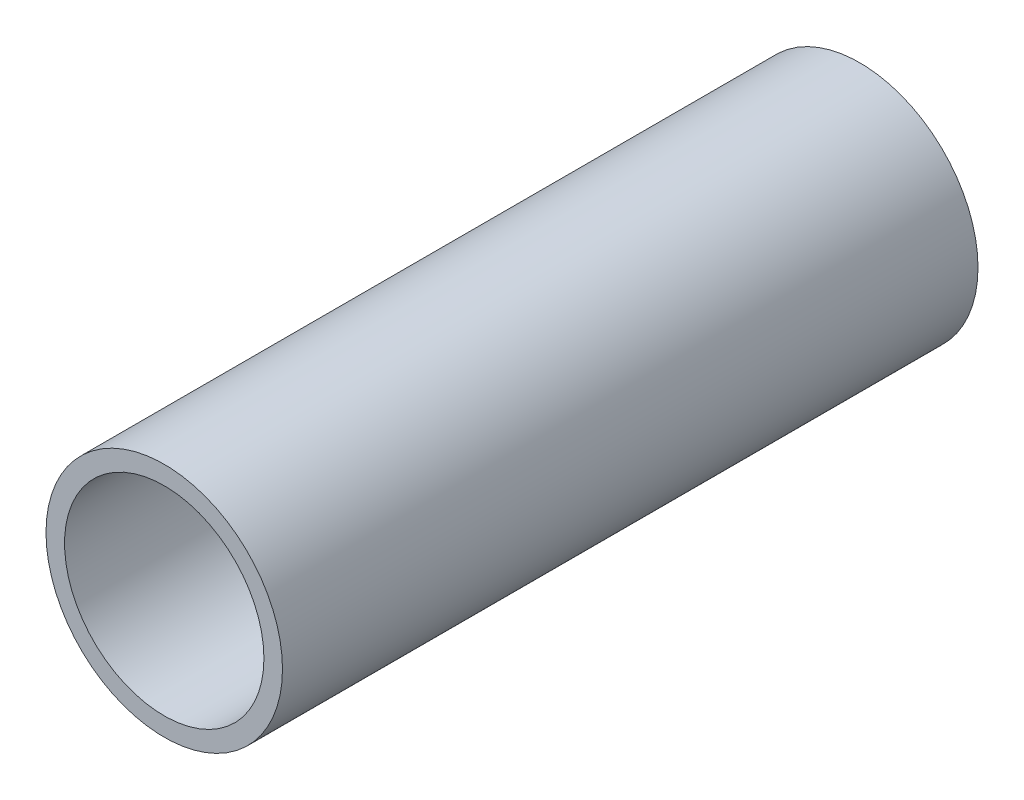
from build123d import *

# Parameters (mm, degrees)
SKETCH3_R           = 2.55
SKETCH3_R_2         = 2.15
BOSS_EXTRUDE1_DEPTH = 15


with BuildPart() as part:
    # Sketch3 → Boss-Extrude1 (new body)
    with BuildSketch(Plane.XY):
        Circle(SKETCH3_R)
        Circle(SKETCH3_R_2, mode=Mode.SUBTRACT)
    extrude(amount=BOSS_EXTRUDE1_DEPTH)


solid = part.part
